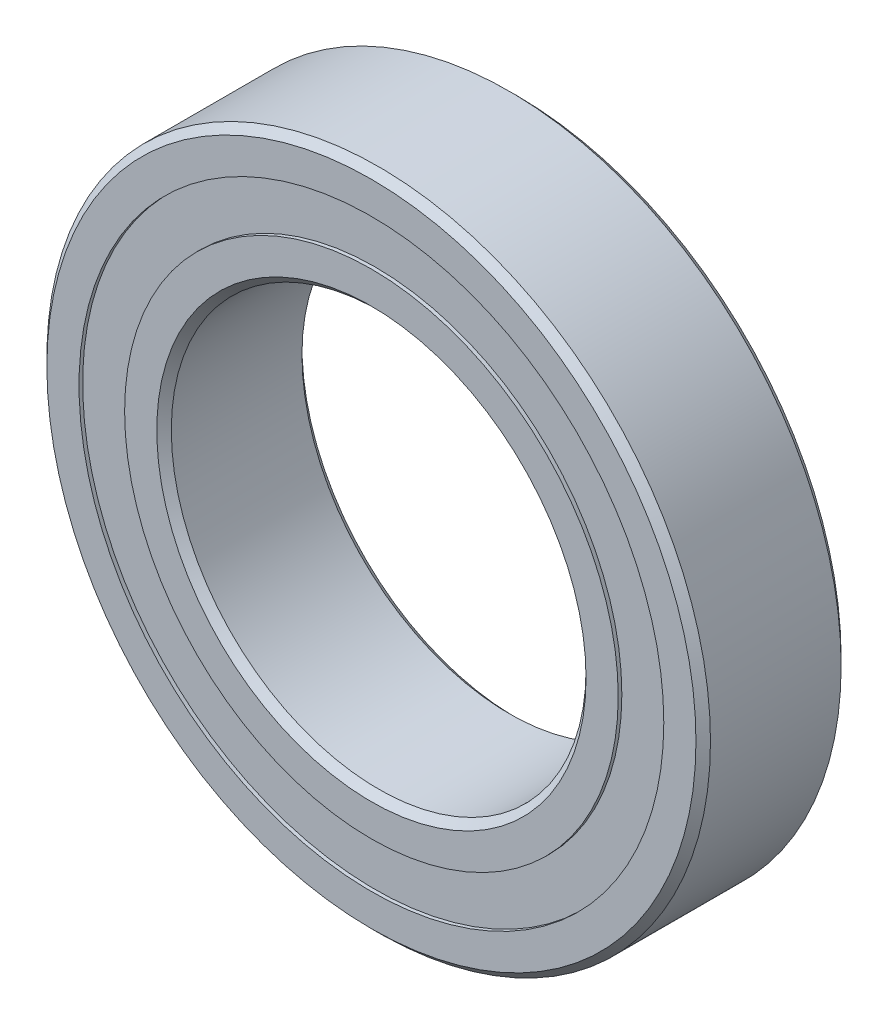
from build123d import *

# Parameters (mm, degrees)
CIRPATTERN1_COUNT = 12
SKETCH5_W         = 1.420443172
SKETCH5_H         = 2.197802198


with BuildPart() as part:
    # Sketch1 → Revolve1 (revolve)
    with BuildSketch(Plane(origin=(0, 0, 0), x_dir=(0, 0, -1), z_dir=(1, 0, 0))):
        with BuildLine():
            Line((3.15, 16), (-3.15, 16))
            Line((-3.15, 16), (-3.5, 15.65))
            Line((-3.5, 15.65), (-3.5, 14.098901099))
            Line((-3.5, 14.098901099), (-1.555555556, 14.098901099))
            ThreePointArc((-1.555555556, 14.098901099), (0, 14.904556828), (1.555555556, 14.098901099))
            Line((1.555555556, 14.098901099), (3.5, 14.098901099))
            Line((3.5, 14.098901099), (3.5, 15.65))
            Line((3.5, 15.65), (3.15, 16))
        make_face()
    revolve(axis=Axis((0, 0, 3.5), (0, 0, -1)))


with BuildPart() as body_2:
    # Sketch3 → Revolve3 (revolve)
    with BuildSketch(Plane(origin=(0, 0, 0), x_dir=(0, 0, -1), z_dir=(1, 0, 0))):
        with BuildLine():
            Line((-3.5, 11.901098901), (-1.555555556, 11.901098901))
            ThreePointArc((-1.555555556, 11.901098901), (0, 11.095443172), (1.555555556, 11.901098901))
            Line((1.555555556, 11.901098901), (3.5, 11.901098901))
            Line((3.5, 11.901098901), (3.5, 10.35))
            Line((3.5, 10.35), (3.15, 10))
            Line((3.15, 10), (-3.15, 10))
            Line((-3.15, 10), (-3.5, 10.35))
            Line((-3.5, 10.35), (-3.5, 11.901098901))
        make_face()
    revolve(axis=Axis((0, 0, 3.5), (0, 0, -1)))


with BuildPart() as body_3:
    # Sketch4 → Revolve4 (revolve)
    with BuildSketch(Plane(origin=(0, 0, 0), x_dir=(0, 0, -1), z_dir=(1, 0, 0))):
        with BuildLine():
            Line((-1.904556828, 13), (1.904556828, 13))
            ThreePointArc((1.904556828, 13), (0, 14.904556828), (-1.904556828, 13))
        make_face()
    revolve(axis=Axis((0, 13, 1.904556828), (0, 0, -1)))


with BuildPart() as cirpattern1_1:
    # CirPattern1: pattern copy
    add(body_3.part.rotate(Axis((0, 0, -3.5), (0, 0, 1)), 1 * 360 / CIRPATTERN1_COUNT))


with BuildPart() as cirpattern1_2:
    # CirPattern1: pattern copy
    add(body_3.part.rotate(Axis((0, 0, -3.5), (0, 0, 1)), 2 * 360 / CIRPATTERN1_COUNT))


with BuildPart() as cirpattern1_3:
    # CirPattern1: pattern copy
    add(body_3.part.rotate(Axis((0, 0, -3.5), (0, 0, 1)), 3 * 360 / CIRPATTERN1_COUNT))


with BuildPart() as cirpattern1_4:
    # CirPattern1: pattern copy
    add(body_3.part.rotate(Axis((0, 0, -3.5), (0, 0, 1)), 4 * 360 / CIRPATTERN1_COUNT))


with BuildPart() as cirpattern1_5:
    # CirPattern1: pattern copy
    add(body_3.part.rotate(Axis((0, 0, -3.5), (0, 0, 1)), 5 * 360 / CIRPATTERN1_COUNT))


with BuildPart() as cirpattern1_6:
    # CirPattern1: pattern copy
    add(body_3.part.rotate(Axis((0, 0, -3.5), (0, 0, 1)), 6 * 360 / CIRPATTERN1_COUNT))


with BuildPart() as cirpattern1_7:
    # CirPattern1: pattern copy
    add(body_3.part.rotate(Axis((0, 0, -3.5), (0, 0, 1)), 7 * 360 / CIRPATTERN1_COUNT))


with BuildPart() as cirpattern1_8:
    # CirPattern1: pattern copy
    add(body_3.part.rotate(Axis((0, 0, -3.5), (0, 0, 1)), 8 * 360 / CIRPATTERN1_COUNT))


with BuildPart() as cirpattern1_9:
    # CirPattern1: pattern copy
    add(body_3.part.rotate(Axis((0, 0, -3.5), (0, 0, 1)), 9 * 360 / CIRPATTERN1_COUNT))


with BuildPart() as cirpattern1_10:
    # CirPattern1: pattern copy
    add(body_3.part.rotate(Axis((0, 0, -3.5), (0, 0, 1)), 10 * 360 / CIRPATTERN1_COUNT))


with BuildPart() as cirpattern1_11:
    # CirPattern1: pattern copy
    add(body_3.part.rotate(Axis((0, 0, -3.5), (0, 0, 1)), 11 * 360 / CIRPATTERN1_COUNT))


with BuildPart() as body_15:
    # Sketch5 → Revolve5 (revolve)
    with BuildSketch(Plane(origin=(0, 0, 0), x_dir=(0, 0, -1), z_dir=(1, 0, 0))):
        with Locations((-2.614778414, 13)):
            Rectangle(SKETCH5_W, SKETCH5_H)
        with Locations((2.614778414, 13)):
            Rectangle(SKETCH5_W, SKETCH5_H)
    revolve(axis=Axis((0, 0, 3.5), (0, 0, -1)))


solid = Compound([part.part, body_2.part, body_3.part, cirpattern1_1.part, cirpattern1_2.part, cirpattern1_3.part, cirpattern1_4.part, cirpattern1_5.part, cirpattern1_6.part, cirpattern1_7.part, cirpattern1_8.part, cirpattern1_9.part, cirpattern1_10.part, cirpattern1_11.part, body_15.part])
